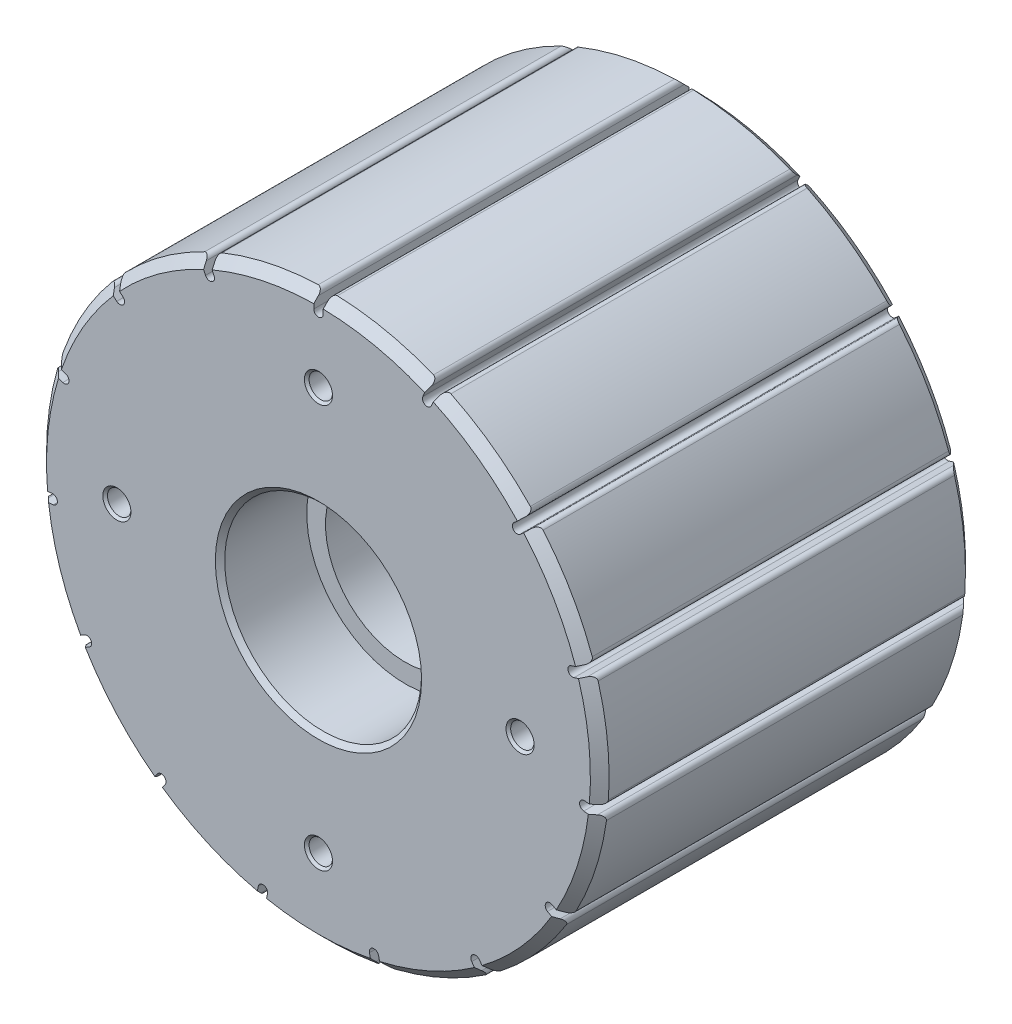
from build123d import *

# Parameters (mm, degrees)
SKETCH2_R                    = 60
SKETCH2_R_2                  = 21
BOSS_EXTRUDE1_DEPTH          = 40
CHAMFER3_SIZE                = 2
CUT_EXTRUDE1_DEPTH           = 94.808315196
FILLET1_R                    = 1
CIRPATTERN1_COUNT            = 15
FILLET1_OF_CIRPATTERN1_R     = 1
SKETCH4_R                    = 21
SKETCH4_R_2                  = 17
BOSS_EXTRUDE2_DEPTH          = 21.5
SKETCH6_W                    = 1.85
SKETCH6_H                    = 23.75
CHAMFER2_SIZE                = 1
SKETCH8_R                    = 2.5
CUT_EXTRUDE2_DEPTH           = 25
CHAMFER1_SIZE                = 0.5
CIRPATTERN2_COUNT            = 4
CHAMFER1_OF_CIRPATTERN2_SIZE = 0.5


with BuildPart() as part:
    # Sketch2 → Boss-Extrude1 (new, symmetric)
    with BuildSketch(Plane.XY):
        Circle(SKETCH2_R)
        Circle(SKETCH2_R_2, mode=Mode.SUBTRACT)
    extrude(amount=BOSS_EXTRUDE1_DEPTH, both=True)

    # Chamfer3
    chamfer3_edges = [part.edges().sort_by_distance(p)[0] for p in [
        (-60, 0, -40),
        (-60, 0, 40),
    ]]
    chamfer(chamfer3_edges, length=CHAMFER3_SIZE)

    # Sketch3 → Cut-Extrude1 (cut, symmetric)
    with BuildSketch(Plane.XY):
        with BuildLine():
            Line((1, 60), (1, 57))
            ThreePointArc((1, 57), (0, 56), (-1, 57))
            Line((-1, 57), (-1, 60))
            ThreePointArc((-1, 60), (0, 61), (1, 60))
        make_face()
    cut_extrude1 = extrude(amount=CUT_EXTRUDE1_DEPTH, both=True, mode=Mode.SUBTRACT)

    # Fillet1
    fillet1_edges = [part.edges().sort_by_distance(p)[0] for p in [
        (-1, 59.991666088, 0),
        (1, 59.991666088, 0),
    ]]
    fillet(fillet1_edges, radius=FILLET1_R)

    # CirPattern1: Cut-Extrude1 ×15 about axis
    cirpattern1_axis = Axis((0, 0, 0), (0, 0, 1))
    for i in range(1, CIRPATTERN1_COUNT):
        add(cut_extrude1.rotate(cirpattern1_axis, i * 360 / CIRPATTERN1_COUNT), mode=Mode.SUBTRACT)

    # Fillet1 of CirPattern1
    fillet1_of_cirpattern1_edges = [part.edges().sort_by_distance(p)[0] for p in [
        (-25.314354335, 54.398377408, 0),
        (-23.487263419, 55.211850694, 0),
        (-45.251626831, 39.39911508, 0),
        (-43.913365619, 40.885404731, 0),
        (-57.364481951, 17.587387826, 0),
        (-56.746447962, 19.489500858, 0),
        (-59.558497001, -7.26535856, 0),
        (-59.767553927, -5.27631477, 0),
        (-51.454306847, -30.861858448, 0),
        (-52.454306847, -29.12980764, 0),
        (-34.453199593, -49.122062638, 0),
        (-36.071233581, -47.946492134, 0),
        (-11.494821131, -58.888615939, 0),
        (-13.451116332, -58.472792557, 0),
        (13.451116332, -58.472792557, 0),
        (11.494821131, -58.888615939, 0),
        (36.071233581, -47.946492134, 0),
        (34.453199593, -49.122062638, 0),
        (52.454306847, -29.12980764, 0),
        (51.454306847, -30.861858448, 0),
        (59.767553927, -5.27631477, 0),
        (59.558497001, -7.26535856, 0),
        (56.746447962, 19.489500858, 0),
        (57.364481951, 17.587387826, 0),
        (43.913365619, 40.885404731, 0),
        (45.251626831, 39.39911508, 0),
        (23.487263419, 55.211850694, 0),
        (25.314354335, 54.398377408, 0),
    ]]
    fillet(fillet1_of_cirpattern1_edges, radius=FILLET1_OF_CIRPATTERN1_R)

    # Sketch4 → Boss-Extrude2 (add, symmetric)
    with BuildSketch(Plane.XY):
        Circle(SKETCH4_R)
        Circle(SKETCH4_R_2, mode=Mode.SUBTRACT)
    extrude(amount=BOSS_EXTRUDE2_DEPTH, both=True)

    # Sketch6 → Cut-Revolve1 (revolve, cut)
    with BuildSketch(Plane(origin=(0, 0, 0), x_dir=(0, 0, -1), z_dir=(1, 0, 0)), mode=Mode.PRIVATE) as cut_revolve1_sk:
        with Locations((34.325, -11.875)):
            Rectangle(SKETCH6_W, SKETCH6_H)
    revolve(cut_revolve1_sk.sketch.rotate(Axis((0, 0, 0), (0, 0, -1)), 270), axis=Axis((0, 0, 0), (0, 0, -1)), mode=Mode.SUBTRACT)

    # Chamfer2
    chamfer2_edges = [part.edges().sort_by_distance(p)[0] for p in [
        (-21, 0, -40),
        (-21, 0, 40),
    ]]
    chamfer(chamfer2_edges, length=CHAMFER2_SIZE)

    # Sketch8 → Cut-Extrude2 (cut)
    with BuildSketch(Plane.XY.offset(40)):
        with Locations((0, 43)):
            Circle(SKETCH8_R)
    cut_extrude2 = extrude(amount=-CUT_EXTRUDE2_DEPTH, mode=Mode.SUBTRACT)

    # Cut-Extrude3 cone 1 section (through the dimple's axis) → Cut-Extrude3 (revolve, cut)
    with BuildSketch(Plane(origin=(0, 43, 15), x_dir=(0, -1, 0), z_dir=(1, 0, 0))):
        Polygon((0, 0), (2.5, 0), (0, 1.165769145), align=None)
    cut_extrude3 = revolve(axis=Axis((0, 43, 15), (0, 0, -1)), mode=Mode.SUBTRACT)

    # Chamfer1
    chamfer1_edges = [part.edges().sort_by_distance(p)[0] for p in [
        (-2.5, 43, 40),
    ]]
    chamfer(chamfer1_edges, length=CHAMFER1_SIZE)

    # CirPattern2: Cut-Extrude2, Cut-Extrude3 ×4 about axis
    cirpattern2_axis = Axis((0, 0, 0), (0, 0, 1))
    add([cut_extrude2.rotate(cirpattern2_axis, i * 360 / CIRPATTERN2_COUNT) for i in range(1, CIRPATTERN2_COUNT)], mode=Mode.SUBTRACT)
    add([cut_extrude3.rotate(cirpattern2_axis, i * 360 / CIRPATTERN2_COUNT) for i in range(1, CIRPATTERN2_COUNT)], mode=Mode.SUBTRACT)

    # Chamfer1 of CirPattern2
    chamfer1_of_cirpattern2_edges = [part.edges().sort_by_distance(p)[0] for p in [
        (-43, -2.5, 40),
        (2.5, -43, 40),
        (43, 2.5, 40),
    ]]
    chamfer(chamfer1_of_cirpattern2_edges, length=CHAMFER1_OF_CIRPATTERN2_SIZE)


solid = part.part
